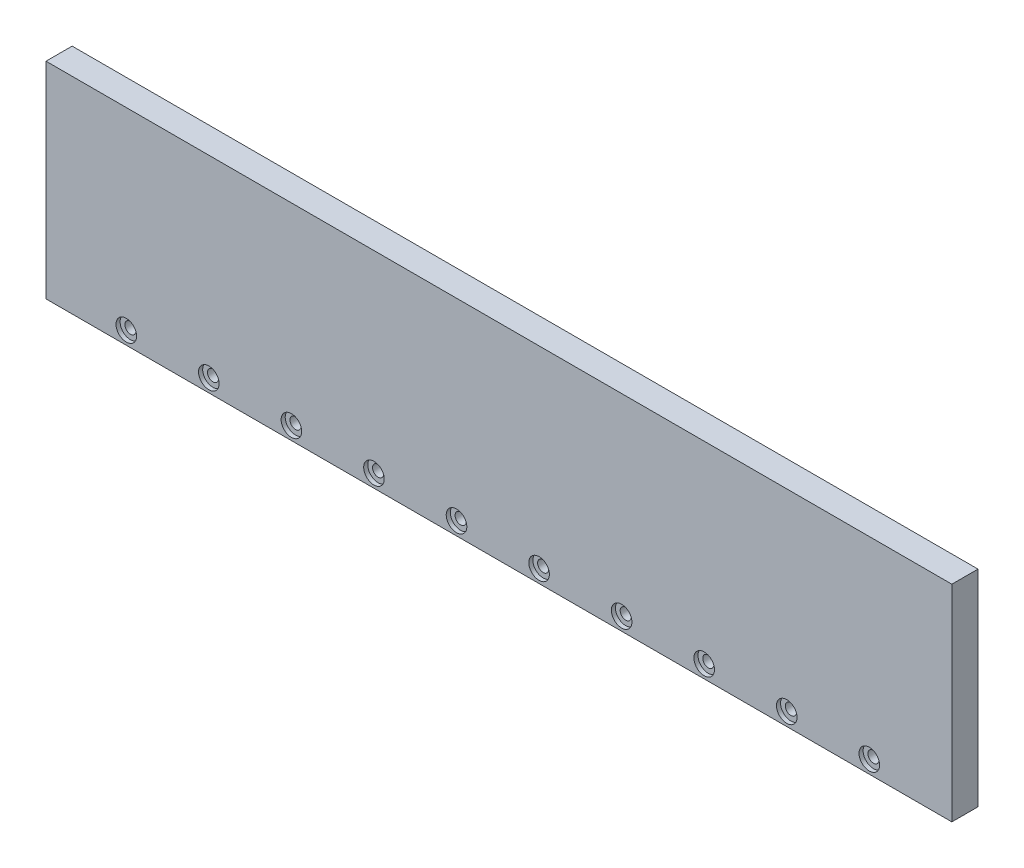
from build123d import *

# Parameters (mm, degrees)
SKETCH1_W                        = 220
SKETCH1_H                        = 50
BOSS_EXTRUDE1_DEPTH              = 3.175
CBORE_FOR_M2_5_SHCS1_D           = 2.7
CBORE_FOR_M2_5_SHCS1_DEPTH       = 15
CBORE_FOR_M2_5_SHCS1_CBORE_D     = 5
CBORE_FOR_M2_5_SHCS1_CBORE_DEPTH = 1
CBORE_FOR_M2_5_SHCS1_TIP         = 0.811161836


with BuildPart() as part:
    # Sketch1 → Boss-Extrude1 (new, symmetric)
    with BuildSketch(Plane.XY):
        Rectangle(SKETCH1_W, SKETCH1_H)
    extrude(amount=BOSS_EXTRUDE1_DEPTH, both=True)

    # CBORE for M2.5 SHCS1
    with Locations(Plane.XY.offset(3.175)):
        with Locations((89.95, -21.825), (69.9, -21.825), (49.85, -21.825), (29.8, -21.825), (9.75, -21.825), (-10.3, -21.825), (-30.35, -21.825), (-50.4, -21.825), (-70.45, -21.825), (-90.5, -21.825)):
            CounterBoreHole(CBORE_FOR_M2_5_SHCS1_D / 2, CBORE_FOR_M2_5_SHCS1_CBORE_D / 2, CBORE_FOR_M2_5_SHCS1_CBORE_DEPTH, depth=CBORE_FOR_M2_5_SHCS1_DEPTH)
            with Locations((0, 0, -(CBORE_FOR_M2_5_SHCS1_DEPTH + CBORE_FOR_M2_5_SHCS1_TIP / 2))):  # 118° drill point
                Cone(0, CBORE_FOR_M2_5_SHCS1_D / 2, CBORE_FOR_M2_5_SHCS1_TIP, mode=Mode.SUBTRACT)


solid = part.part
